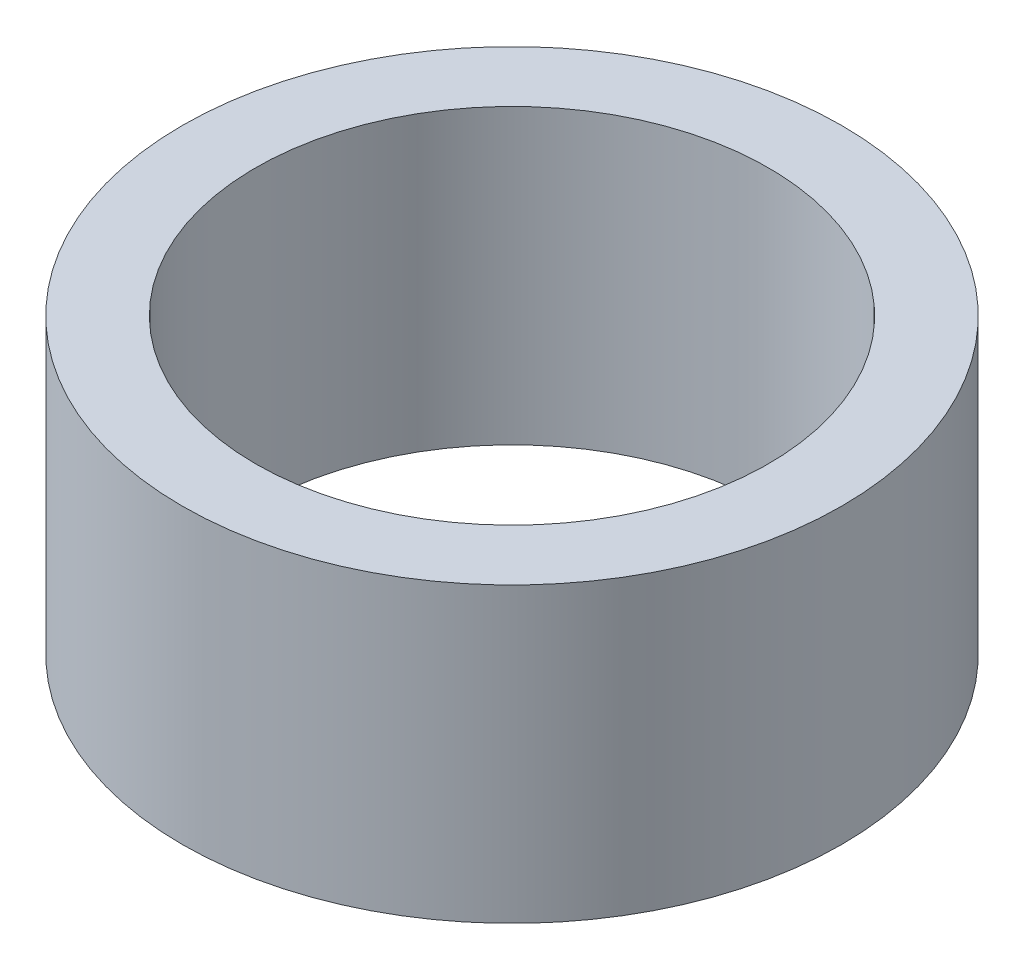
from build123d import *

# Parameters (mm, degrees)
SKETCH1_R           = 28.575
SKETCH1_R_2         = 22.225
BOSS_EXTRUDE1_DEPTH = 25.4


with BuildPart() as part:
    # Sketch1 → Boss-Extrude1 (new body)
    with BuildSketch(Plane(origin=(0, 0, 0), x_dir=(1, 0, 0), z_dir=(0, 1, 0))):
        with Locations(Location((0, 0, 0), (0, 0, 270))):
            Circle(SKETCH1_R)
        with Locations(Location((0, 0, 0), (0, 0, 270))):
            Circle(SKETCH1_R_2, mode=Mode.SUBTRACT)
    extrude(amount=BOSS_EXTRUDE1_DEPTH)


solid = part.part
